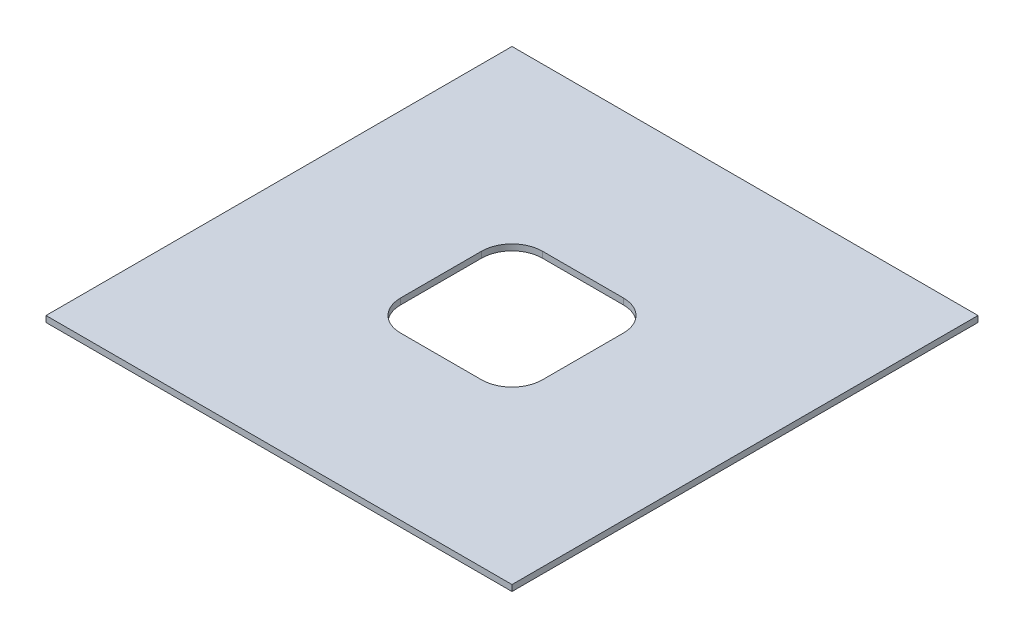
from build123d import *

# Parameters (mm, degrees)
SKETCH1_W           = 230
SKETCH1_H           = 230
BOSS_EXTRUDE1_DEPTH = 3


with BuildPart() as part:
    # Sketch1 → Boss-Extrude1 (new body)
    with BuildSketch(Plane(origin=(0, 0, 0), x_dir=(1, 0, 0), z_dir=(0, 1, 0))):
        Rectangle(SKETCH1_W, SKETCH1_H)
        with BuildLine():
            Line((-20, -35), (20, -35))
            ThreePointArc((20, -35), (30.606601718, -30.606601718), (35, -20))
            Line((35, -20), (35, 20))
            ThreePointArc((35, 20), (30.606601718, 30.606601718), (20, 35))
            Line((20, 35), (-20, 35))
            ThreePointArc((-20, 35), (-30.606601718, 30.606601718), (-35, 20))
            Line((-35, 20), (-35, -20))
            ThreePointArc((-35, -20), (-30.606601718, -30.606601718), (-20, -35))
        make_face(mode=Mode.SUBTRACT)
    extrude(amount=BOSS_EXTRUDE1_DEPTH)


solid = part.part
